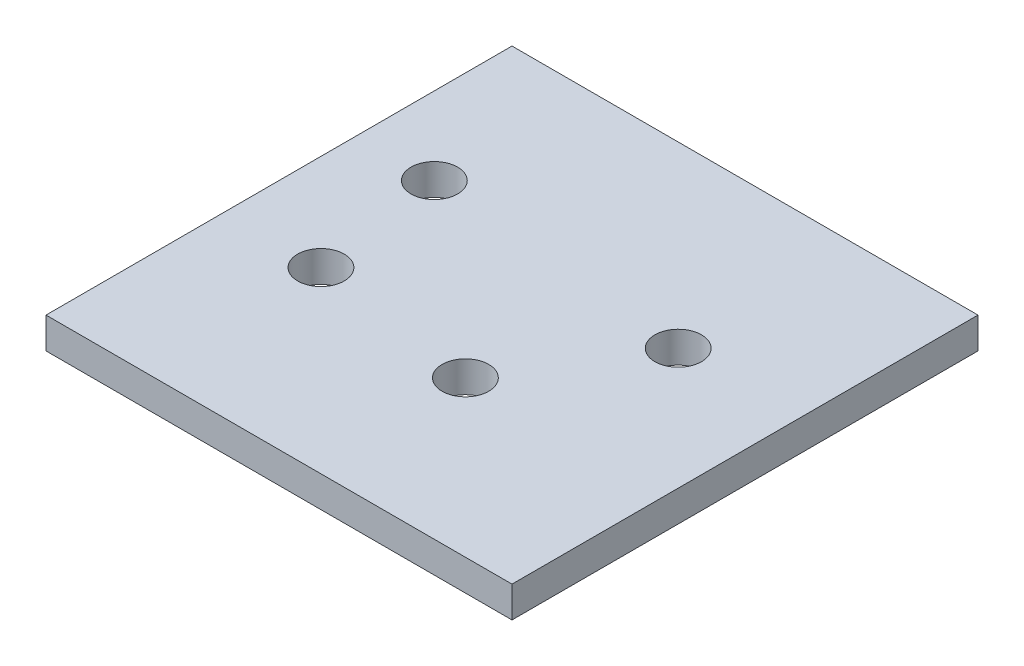
from build123d import *

# Parameters (mm, degrees)
SKETCH_1_W      = 30
SKETCH_1_H      = 30
SKETCH_1_R      = 1.5
EXTRUDE_1_DEPTH = 2


with BuildPart() as part:
    # 草图1 → 凸台-拉伸1 (new body)
    with BuildSketch(Plane(origin=(0, 0, 0), x_dir=(1, 0, 0), z_dir=(0, 1, 0))):
        with Locations((-8.629299764, 2.478388751)):
            Rectangle(SKETCH_1_W, SKETCH_1_H)
        with Locations(Location((-17.429299764, -1.021611249, 0), (0, 0, 270))):
            Circle(SKETCH_1_R, mode=Mode.SUBTRACT)
        with Locations(Location((-6.629299764, -2.521611249, 0), (0, 0, 270))):
            Circle(SKETCH_1_R, mode=Mode.SUBTRACT)
        with Locations(Location((-18.629299764, 7.478388751, 0), (0, 0, 270))):
            Circle(SKETCH_1_R, mode=Mode.SUBTRACT)
        with Locations(Location((-1.429299764, 5.978388751, 0), (0, 0, 270))):
            Circle(SKETCH_1_R, mode=Mode.SUBTRACT)
    extrude(amount=EXTRUDE_1_DEPTH)


solid = part.part
